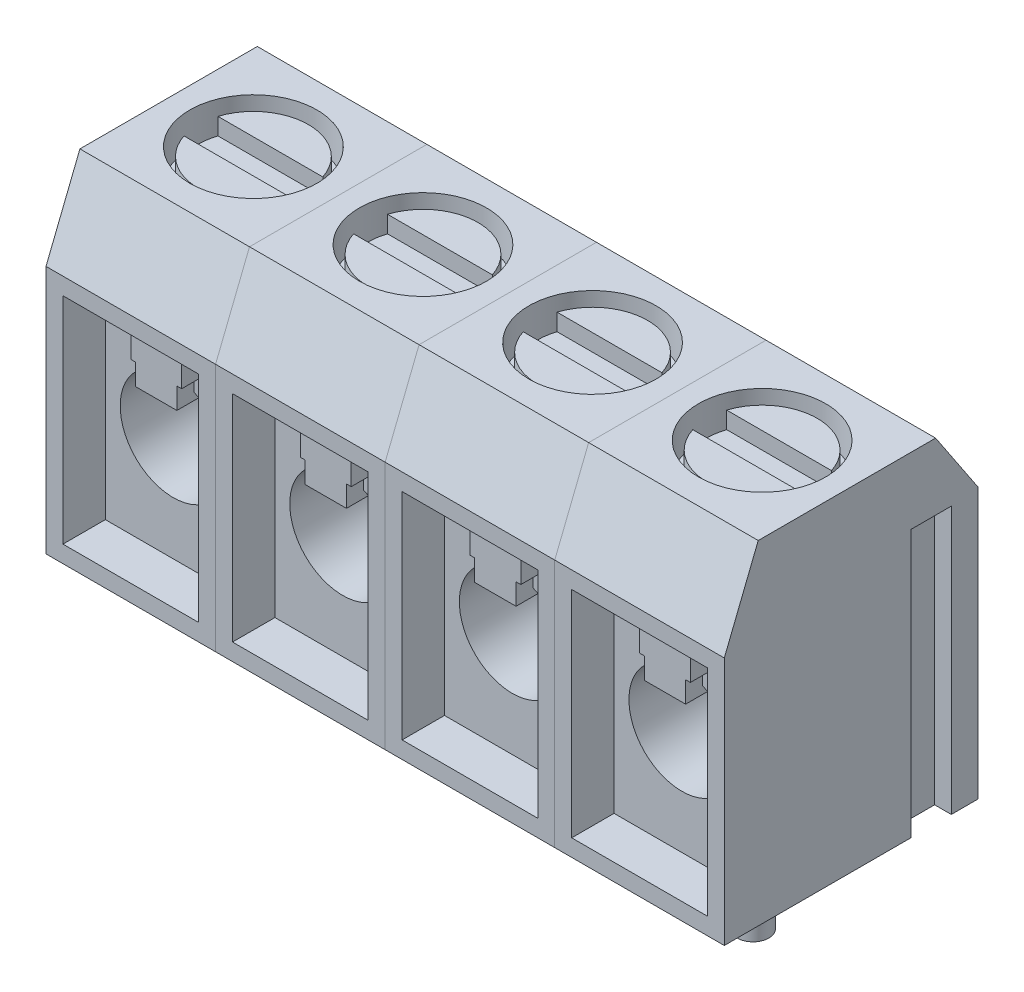
from build123d import *

# Parameters (mm, degrees)
SKETCH1_W                = 5.08
SKETCH1_H                = 7.6
BOSS_EXTRUDE1_DEPTH      = 10
CUT_EXTRUDE1_DEPTH       = 12.842567289
SKETCH3_R                = 1.905
CUT_EXTRUDE2_DEPTH       = 1.016
SKETCH10_R               = 1.651
BOSS_EXTRUDE6_DEPTH      = 0.762
SKETCH11_W               = 3.302
SKETCH11_H               = 1.016
CUT_EXTRUDE5_DEPTH       = 0.508
SKETCH4_W                = 4.064
SKETCH4_H                = 6.444
CUT_EXTRUDE3_DEPTH       = 6.33
SKETCH5_W                = 4.064
SKETCH5_H                = 5.936
BOSS_EXTRUDE2_DEPTH      = 5.06
SKETCH6_R                = 1.5875
CUT_EXTRUDE4_DEPTH       = 5.08
BOSS_EXTRUDE3_DEPTH      = 0.508
BOSS_EXTRUDE3_DEPTH_BACK = 5.06
SKETCH7_W                = 1.237290892
SKETCH7_H                = 2.032
SKETCH8_W                = 1.524
SKETCH8_H                = 0.762
BOSS_EXTRUDE4_DEPTH      = 0.508
SKETCH9_R                = 0.475
BOSS_EXTRUDE5_DEPTH      = 2.54
SKETCH15_W               = 1.2
SKETCH15_H               = 8
BOSS_EXTRUDE8_DEPTH      = 0.5
SKETCH16_W               = 0.5
SKETCH16_H               = 1.2
CUT_EXTRUDE7_DEPTH       = 8
LPATTERN1_COUNT          = 4
LPATTERN1_PITCH          = 5.08


with BuildPart() as part:
    # Sketch1 → Boss-Extrude1 (new body)
    with BuildSketch(Plane(origin=(0, 0, 0), x_dir=(1, 0, 0), z_dir=(0, 1, 0))):
        Rectangle(SKETCH1_W, SKETCH1_H)
    extrude(amount=BOSS_EXTRUDE1_DEPTH)

    # Sketch2 → Cut-Extrude1 (cut, through all)
    with BuildSketch(Plane(origin=(2.54, 0, 0), x_dir=(0, 0, -1), z_dir=(1, 0, 0))):
        Polygon((-2.784, 10), (-3.8, 10), (-3.8, 7.46), align=None)
        Polygon((2.53, 10), (3.8, 10), (3.8, 8.095), align=None)
    extrude(amount=-CUT_EXTRUDE1_DEPTH, mode=Mode.SUBTRACT)

    # Sketch3 → Cut-Extrude2 (cut)
    with BuildSketch(Plane(origin=(0, 10, 0), x_dir=(1, 0, 0), z_dir=(0, 1, 0))):
        with Locations(Location((0, -0.127, 0), (0, 0, 270))):
            Circle(SKETCH3_R)
    extrude(amount=-CUT_EXTRUDE2_DEPTH, mode=Mode.SUBTRACT)

    # Sketch10 → Boss-Extrude6 (add)
    with BuildSketch(Plane(origin=(0, 8.984, 0), x_dir=(1, 0, 0), z_dir=(0, 1, 0))):
        with Locations(Location((0, -0.127, 0), (0, 0, 90))):
            Circle(SKETCH10_R)
    extrude(amount=BOSS_EXTRUDE6_DEPTH)

    # Sketch11 → Cut-Extrude5 (cut)
    with BuildSketch(Plane(origin=(0, 9.746, 0), x_dir=(1, 0, 0), z_dir=(0, 1, 0))):
        with Locations((0, -0.127)):
            Rectangle(SKETCH11_W, SKETCH11_H)
    extrude(amount=-CUT_EXTRUDE5_DEPTH, mode=Mode.SUBTRACT)

    # Sketch4 → Cut-Extrude3 (cut)
    with BuildSketch(Plane.XY.offset(3.8)):
        with Locations((0, 3.73)):
            Rectangle(SKETCH4_W, SKETCH4_H)
    extrude(amount=-CUT_EXTRUDE3_DEPTH, mode=Mode.SUBTRACT)

    # Sketch5 → Boss-Extrude2 (add)
    with BuildSketch(Plane.XY.offset(-2.53)):
        with Locations((0, 3.476)):
            Rectangle(SKETCH5_W, SKETCH5_H)
    extrude(amount=BOSS_EXTRUDE2_DEPTH)

    # Sketch6 → Cut-Extrude4 (cut)
    with BuildSketch(Plane.XY.offset(2.53)):
        with Locations((0, 3.683)):
            Circle(SKETCH6_R)
    extrude(amount=-CUT_EXTRUDE4_DEPTH, mode=Mode.SUBTRACT)

    # Sketch7 → Boss-Extrude3 (add, two sides: drawn at the far end of the back side and taken through both)
    with BuildSketch(Plane.XY.offset(2.53).offset(-BOSS_EXTRUDE3_DEPTH_BACK)):
        with Locations((0, 5.936)):
            Rectangle(SKETCH7_W, SKETCH7_H)
    extrude(amount=BOSS_EXTRUDE3_DEPTH + BOSS_EXTRUDE3_DEPTH_BACK)

    # Sketch8 → Boss-Extrude4 (add)
    with BuildSketch(Plane.XY.offset(3.038)):
        with Locations((0, 5.936)):
            Rectangle(SKETCH8_W, SKETCH8_H)
    extrude(amount=-BOSS_EXTRUDE4_DEPTH)

    # Sketch9 → Boss-Extrude5 (add)
    with BuildSketch(Plane.XZ):
        with Locations(Location((0, 0.4, 0), (0, 0, 270))):
            Circle(SKETCH9_R)
    extrude(amount=BOSS_EXTRUDE5_DEPTH)

    # Sketch15 → Boss-Extrude8 (add)
    with BuildSketch(Plane.ZY.offset(2.54)):
        with Locations((-2.4, 4)):
            Rectangle(SKETCH15_W, SKETCH15_H)
    extrude(amount=BOSS_EXTRUDE8_DEPTH)

    # Sketch16 → Cut-Extrude7 (cut)
    with BuildSketch(Plane.XZ):
        with Locations((2.29, -2.4)):
            Rectangle(SKETCH16_W, SKETCH16_H)
    extrude(amount=-CUT_EXTRUDE7_DEPTH, mode=Mode.SUBTRACT)


with BuildPart() as lpattern1_1:
    # LPattern1: pattern copy
    add(part.part.moved(Location(Vector(-1, 0, 0) * (1 * LPATTERN1_PITCH))))


with BuildPart() as lpattern1_2:
    # LPattern1: pattern copy
    add(part.part.moved(Location(Vector(-1, 0, 0) * (2 * LPATTERN1_PITCH))))


with BuildPart() as lpattern1_3:
    # LPattern1: pattern copy
    add(part.part.moved(Location(Vector(-1, 0, 0) * (3 * LPATTERN1_PITCH))))


solid = Compound([part.part, lpattern1_1.part, lpattern1_2.part, lpattern1_3.part])
